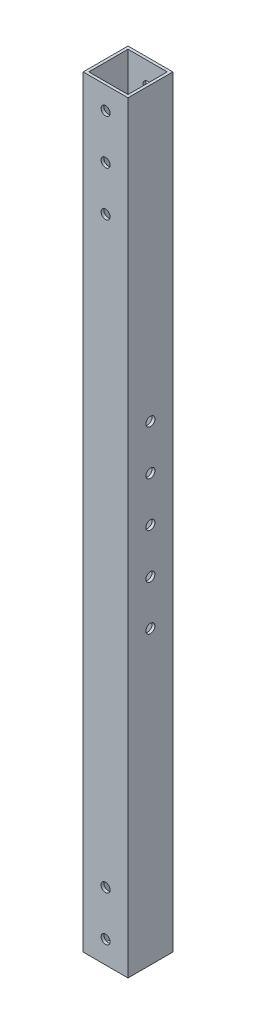
from build123d import *

# Parameters (mm, degrees)
SKETCH1_W                  = 25.4
SKETCH1_H                  = 25.4
SKETCH1_W_2                = 22.225
SKETCH1_H_2                = 22.225
BOSS_EXTRUDE1_DEPTH        = 431.8
F_7_0_201_DIAMETER_HOLE1_D = 5.1054
F_7_0_201_DIAMETER_HOLE2_D = 5.1054


with BuildPart() as part:
    # Sketch1 → Boss-Extrude1 (new body)
    with BuildSketch(Plane(origin=(0, 0, 0), x_dir=(1, 0, 0), z_dir=(0, 1, 0))):
        Rectangle(SKETCH1_W, SKETCH1_H)
        Rectangle(SKETCH1_W_2, SKETCH1_H_2, mode=Mode.SUBTRACT)
    extrude(amount=BOSS_EXTRUDE1_DEPTH)

    # #7 (0.201) Diameter Hole1 (through all)
    with Locations(Plane.XY.offset(12.7)):
        with Locations((0, 12.7), (0, 38.1), (0, 368.3), (0, 393.7), (0, 419.1)):
            Hole(F_7_0_201_DIAMETER_HOLE1_D / 2)

    # #7 (0.201) Diameter Hole2 (through all)
    with Locations(Plane(origin=(12.7, 0, 0), x_dir=(0, 0, -1), z_dir=(1, 0, 0))):
        with Locations((0, 165.1), (0, 190.5), (0, 215.9), (0, 241.3), (0, 266.7)):
            Hole(F_7_0_201_DIAMETER_HOLE2_D / 2)


solid = part.part
